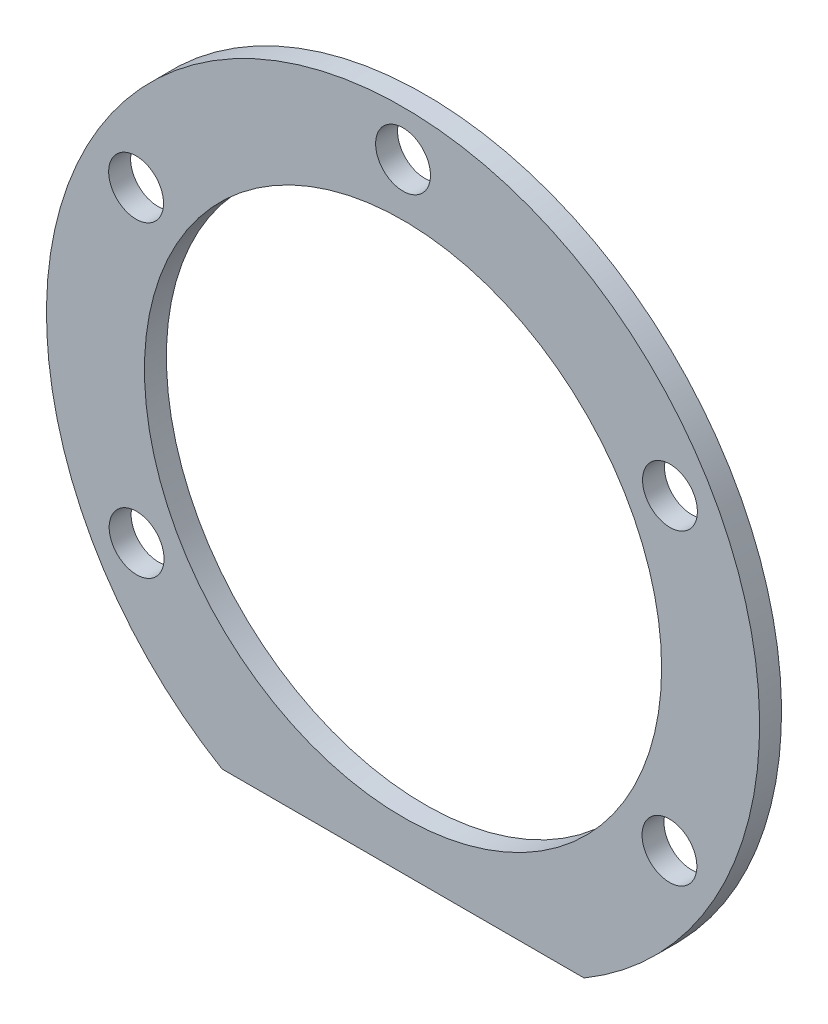
from build123d import *

# Parameters (mm, degrees)
SKETCH1_R           = 23.57
SKETCH1_R_2         = 2.5
BOSS_EXTRUDE1_DEPTH = 5
SKETCH2_W           = 65
SKETCH2_H           = 3
CUT_EXTRUDE1_DEPTH  = 70


with BuildPart() as part:
    # Sketch1 → Boss-Extrude1 (new body)
    with BuildSketch(Plane.XY):
        with BuildLine():
            Line((-16.5, -28), (16.5, -28))
            ThreePointArc((16.5, -28), (0, 32.5), (-16.5, -28))
        make_face()
        Circle(SKETCH1_R, mode=Mode.SUBTRACT)
        with Locations((24.283327614, -14.06)):
            Circle(SKETCH1_R_2, mode=Mode.SUBTRACT)
        with Locations((24.32947184, 13.98)):
            Circle(SKETCH1_R_2, mode=Mode.SUBTRACT)
        with Locations((0, 28.358420848)):
            Circle(SKETCH1_R_2, mode=Mode.SUBTRACT)
        with Locations((-24.32947184, 13.98)):
            Circle(SKETCH1_R_2, mode=Mode.SUBTRACT)
        with Locations((-24.283327614, -14.06)):
            Circle(SKETCH1_R_2, mode=Mode.SUBTRACT)
    extrude(amount=BOSS_EXTRUDE1_DEPTH)

    # Sketch2 → Cut-Extrude1 (cut)
    with BuildSketch(Plane(origin=(0, -28, 0), x_dir=(-1, 0, 0), z_dir=(0, -1, 0))):
        with Locations((0, -1.5)):
            Rectangle(SKETCH2_W, SKETCH2_H)
    extrude(amount=-CUT_EXTRUDE1_DEPTH, mode=Mode.SUBTRACT)


solid = part.part
